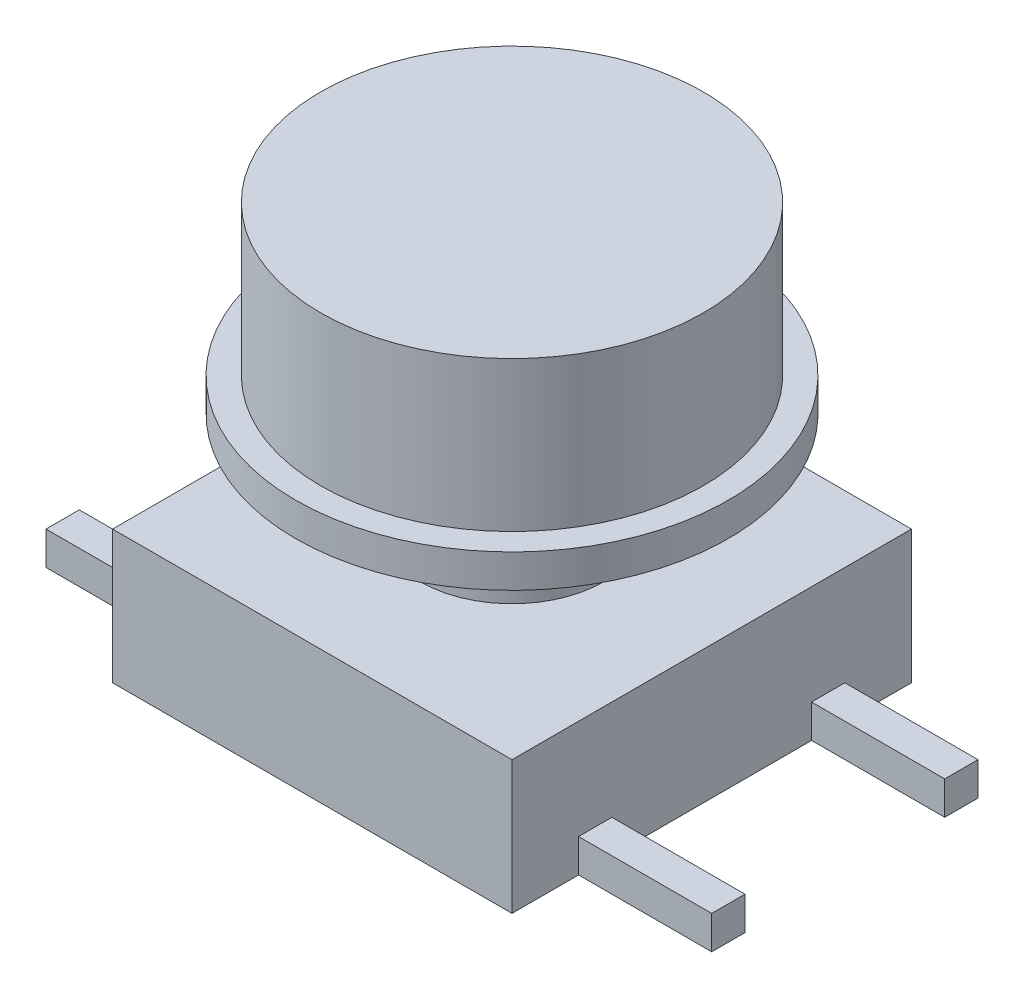
from build123d import *

# Parameters (mm, degrees)
SKETCH1_W               = 12
SKETCH1_H               = 12
BOSS_EXTRUDE1_DEPTH     = 4
SKETCH2_R               = 2.75
BOSS_EXTRUDE2_DEPTH     = 3
SKETCH3_R               = 6.5
BOSS_EXTRUDE3_DEPTH     = 1
BOSS_EXTRUDE4_START     = -1
SKETCH4_R               = 5.75
BOSS_EXTRUDE4_DEPTH     = 5.5
SKETCH5_W               = 1
SKETCH5_H               = 1
BOSS_EXTRUDE5_DEPTH     = 4
MIRROR2_COPY_1_SKETCH_W = 1
MIRROR2_COPY_1_SKETCH_H = 1
MIRROR2_COPY_1_DEPTH    = 4


with BuildPart() as part:
    # Sketch1 → Boss-Extrude1 (new body)
    with BuildSketch(Plane(origin=(0, 0, 0), x_dir=(1, 0, 0), z_dir=(0, 1, 0))):
        Rectangle(SKETCH1_W, SKETCH1_H)
    extrude(amount=BOSS_EXTRUDE1_DEPTH)

    # Sketch2 → Boss-Extrude2 (add)
    with BuildSketch(Plane(origin=(0, 4, 0), x_dir=(1, 0, 0), z_dir=(0, 1, 0))):
        with Locations(Location((0, 0, 0), (0, 0, 270))):
            Circle(SKETCH2_R)
    extrude(amount=BOSS_EXTRUDE2_DEPTH)

    # Sketch3 → Boss-Extrude3 (add)
    with BuildSketch(Plane(origin=(0, 7, 0), x_dir=(1, 0, 0), z_dir=(0, 1, 0))):
        with Locations(Location((0, 0, 0), (0, 0, 270))):
            Circle(SKETCH3_R)
    extrude(amount=BOSS_EXTRUDE3_DEPTH)

    # Sketch4 → Boss-Extrude4 (add)
    with BuildSketch(Plane(origin=(0, 8, 0), x_dir=(1, 0, 0), z_dir=(0, 1, 0)).offset(BOSS_EXTRUDE4_START)):
        with Locations(Location((0, 0, 0), (0, 0, 270))):
            Circle(SKETCH4_R)
    extrude(amount=BOSS_EXTRUDE4_DEPTH)

    # Sketch5 → Boss-Extrude5 (add)
    with BuildSketch(Plane(origin=(6, 0, 0), x_dir=(0, 0, -1), z_dir=(1, 0, 0))):
        with Locations((-3.5, 0.5)):
            Rectangle(SKETCH5_W, SKETCH5_H)
    boss_extrude5 = extrude(amount=BOSS_EXTRUDE5_DEPTH)

    # Mirror1: Boss-Extrude5 across plane
    add(boss_extrude5.mirror(Plane.XY))

    # Mirror2: Boss-Extrude5 across plane
    add(boss_extrude5.mirror(Plane(origin=(0, 0, 0), x_dir=(0, 0, 1), z_dir=(1, 0, 0))))

    # Mirror2 copy 1 sketch → Mirror2 copy 1 (add)
    with BuildSketch(Plane.ZY.offset(6)):
        with Locations((-3.5, 0.5)):
            Rectangle(MIRROR2_COPY_1_SKETCH_W, MIRROR2_COPY_1_SKETCH_H)
    extrude(amount=MIRROR2_COPY_1_DEPTH)


solid = part.part
